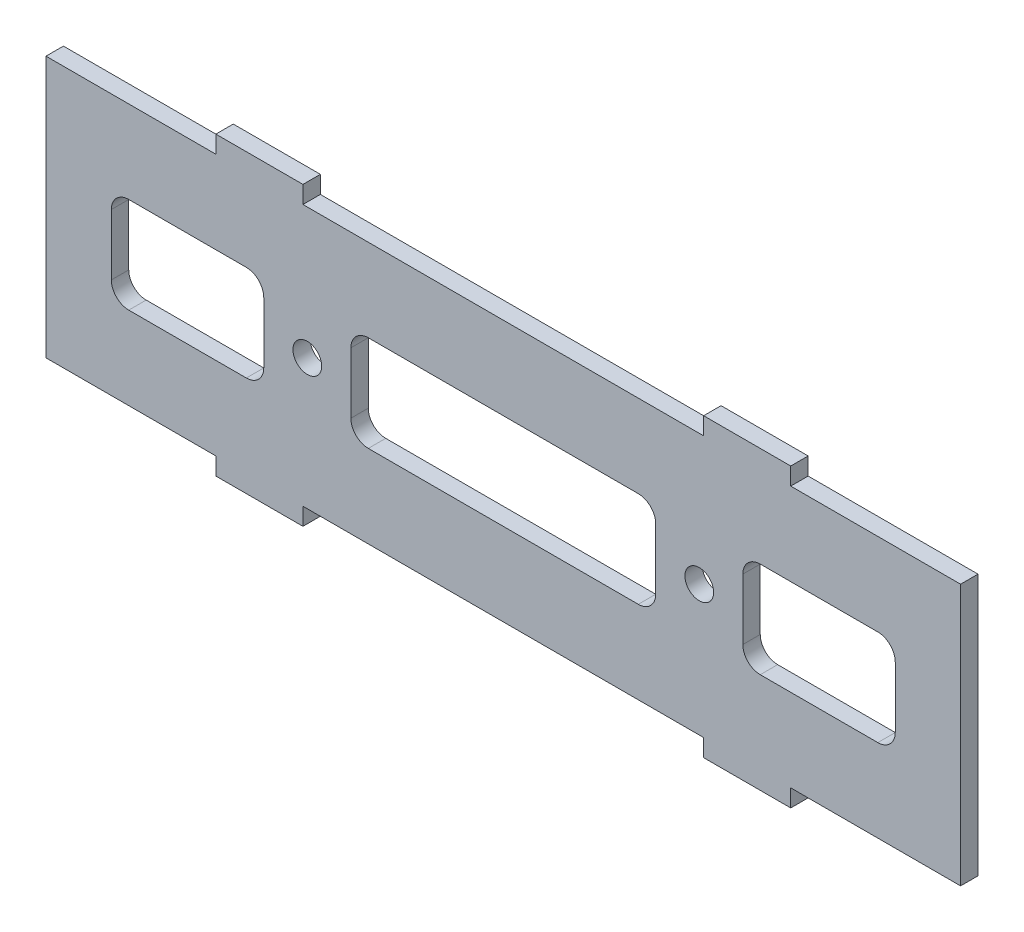
from build123d import *

# Parameters (mm, degrees)
EXTRUDE_1_DEPTH     = 2
SKETCH_2_W          = 90
SKETCH_2_H          = 11
CUT_EXTRUDE_1_DEPTH = 2
SKETCH_4_W          = 10
SKETCH_4_H          = 11
SKETCH_4_R          = 1.65
EXTRUDE_3_DEPTH     = 2
FILLET_2_R          = 2


with BuildPart() as part:
    # 草图1 → 凸台-拉伸1 (new body)
    with BuildSketch(Plane.XY):
        Polygon((-33, -15), (-52.5, -15), (-52.5, 15), (-33, 15), (-33, 17), (-23, 17), (-23, 15), (23, 15), (23, 17), (33, 17), (33, 15), (52.5, 15), (52.5, -15), (33, -15), (33, -17), (23, -17), (23, -15), (-23, -15), (-23, -17), (-33, -17), align=None)
    extrude(amount=EXTRUDE_1_DEPTH)

    # 草图2 → 切除-拉伸1 (cut)
    with BuildSketch(Plane.XY.offset(2)):
        Rectangle(SKETCH_2_W, SKETCH_2_H)
    extrude(amount=-CUT_EXTRUDE_1_DEPTH, mode=Mode.SUBTRACT)

    # 草图4 → 凸台-拉伸3 (add)
    # profile 1 of 2: a face of its own
    with BuildSketch(Plane(origin=(0, 0, 0), x_dir=(-1, 0, 0), z_dir=(0, 0, -1))):
        with Locations((-22.5, 0)):
            Rectangle(SKETCH_4_W, SKETCH_4_H)
        with Locations((-22.5, 0)):
            Circle(SKETCH_4_R, mode=Mode.SUBTRACT)
    # profile 2 of 2: a face of its own
    with BuildSketch(Plane(origin=(0, 0, 0), x_dir=(-1, 0, 0), z_dir=(0, 0, -1))):
        with Locations((22.5, 0)):
            Rectangle(SKETCH_4_W, SKETCH_4_H)
        with Locations((22.5, 0)):
            Circle(SKETCH_4_R, mode=Mode.SUBTRACT)
    extrude(amount=-EXTRUDE_3_DEPTH)

    # 圆角2
    fillet_2_edges = [part.edges().sort_by_distance(p)[0] for p in [
        (-45, -5.5, 1),
        (-45, 5.5, 1),
        (45, 5.5, 1),
        (45, -5.5, 1),
        (17.5, -5.5, 1),
        (17.5, 5.5, 1),
        (27.5, 5.5, 1),
        (27.5, -5.5, 1),
        (-27.5, -5.5, 1),
        (-27.5, 5.5, 1),
        (-17.5, 5.5, 1),
        (-17.5, -5.5, 1),
    ]]
    fillet(fillet_2_edges, radius=FILLET_2_R)


solid = part.part
